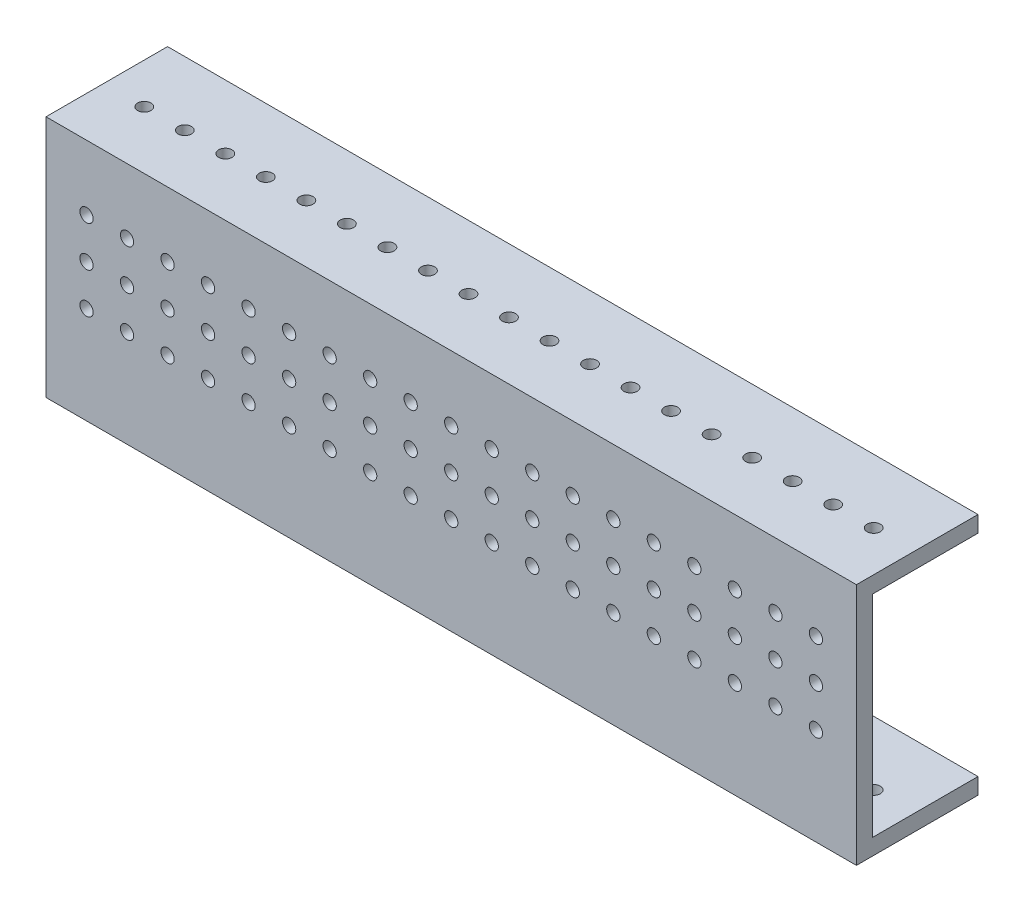
from build123d import *

# Parameters (mm, degrees)
BOSS_EXTRUDE1_DEPTH = 127
SKETCH2_R           = 2.0828
CUT_EXTRUDE1_DEPTH  = 150.326295407
SKETCH3_R           = 2.0828
CUT_EXTRUDE2_DEPTH  = 5.08


with BuildPart() as part:
    # Sketch1 → Boss-Extrude1 (new, symmetric)
    with BuildSketch(Plane(origin=(0, 0, 0), x_dir=(0, 0, -1), z_dir=(1, 0, 0))):
        Polygon((-13.97, 33.02), (19.05, 33.02), (19.05, 38.1), (-19.05, 38.1), (-19.05, -38.1), (19.05, -38.1), (19.05, -33.02), (-13.97, -33.02), align=None)
    extrude(amount=BOSS_EXTRUDE1_DEPTH, both=True)

    # Sketch2 → Cut-Extrude1 (cut, through all)
    with BuildSketch(Plane(origin=(0, 38.1, 0), x_dir=(1, 0, 0), z_dir=(0, 1, 0))):
        with Locations(Location((-114.3, -0.945134, 0), (0, 0, 270))):
            Circle(SKETCH2_R)
        with Locations(Location((-101.6, -0.945134, 0), (0, 0, 270))):
            Circle(SKETCH2_R)
        with Locations(Location((-88.9, -0.945134, 0), (0, 0, 270))):
            Circle(SKETCH2_R)
        with Locations(Location((-76.2, -0.945134, 0), (0, 0, 270))):
            Circle(SKETCH2_R)
        with Locations(Location((-63.5, -0.945134, 0), (0, 0, 270))):
            Circle(SKETCH2_R)
        with Locations(Location((-50.8, -0.945134, 0), (0, 0, 270))):
            Circle(SKETCH2_R)
        with Locations(Location((-38.1, -0.945134, 0), (0, 0, 270))):
            Circle(SKETCH2_R)
        with Locations(Location((-25.4, -0.945134, 0), (0, 0, 270))):
            Circle(SKETCH2_R)
        with Locations(Location((-12.7, -0.945134, 0), (0, 0, 270))):
            Circle(SKETCH2_R)
        with Locations(Location((0, -0.945134, 0), (0, 0, 270))):
            Circle(SKETCH2_R)
        with Locations(Location((12.7, -0.945134, 0), (0, 0, 270))):
            Circle(SKETCH2_R)
        with Locations(Location((25.4, -0.945134, 0), (0, 0, 270))):
            Circle(SKETCH2_R)
        with Locations(Location((38.1, -0.945134, 0), (0, 0, 270))):
            Circle(SKETCH2_R)
        with Locations(Location((50.8, -0.945134, 0), (0, 0, 270))):
            Circle(SKETCH2_R)
        with Locations(Location((63.5, -0.945134, 0), (0, 0, 270))):
            Circle(SKETCH2_R)
        with Locations(Location((76.2, -0.945134, 0), (0, 0, 270))):
            Circle(SKETCH2_R)
        with Locations(Location((88.9, -0.945134, 0), (0, 0, 270))):
            Circle(SKETCH2_R)
        with Locations(Location((101.6, -0.945134, 0), (0, 0, 270))):
            Circle(SKETCH2_R)
        with Locations(Location((114.3, -0.945134, 0), (0, 0, 270))):
            Circle(SKETCH2_R)
    extrude(amount=-CUT_EXTRUDE1_DEPTH, mode=Mode.SUBTRACT)

    # Sketch3 → Cut-Extrude2 (cut)
    with BuildSketch(Plane.XY.offset(19.05)):
        with Locations((-114.3, 17.78)):
            Circle(SKETCH3_R)
        with Locations((-101.6, 17.78)):
            Circle(SKETCH3_R)
        with Locations((-88.9, 17.78)):
            Circle(SKETCH3_R)
        with Locations((-76.2, 17.78)):
            Circle(SKETCH3_R)
        with Locations((-63.5, 17.78)):
            Circle(SKETCH3_R)
        with Locations((-50.8, 17.78)):
            Circle(SKETCH3_R)
        with Locations((-38.1, 17.78)):
            Circle(SKETCH3_R)
        with Locations((-25.4, 17.78)):
            Circle(SKETCH3_R)
        with Locations((-12.7, 17.78)):
            Circle(SKETCH3_R)
        with Locations((0, 17.78)):
            Circle(SKETCH3_R)
        with Locations((12.7, 17.78)):
            Circle(SKETCH3_R)
        with Locations((25.4, 17.78)):
            Circle(SKETCH3_R)
        with Locations((38.1, 17.78)):
            Circle(SKETCH3_R)
        with Locations((50.8, 17.78)):
            Circle(SKETCH3_R)
        with Locations((63.5, 17.78)):
            Circle(SKETCH3_R)
        with Locations((76.2, 17.78)):
            Circle(SKETCH3_R)
        with Locations((88.9, 17.78)):
            Circle(SKETCH3_R)
        with Locations((101.6, 17.78)):
            Circle(SKETCH3_R)
        with Locations((114.3, 17.78)):
            Circle(SKETCH3_R)
        with Locations((-101.6, 5.08)):
            Circle(SKETCH3_R)
        with Locations((-88.9, 5.08)):
            Circle(SKETCH3_R)
        with Locations((-76.2, 5.08)):
            Circle(SKETCH3_R)
        with Locations((-63.5, 5.08)):
            Circle(SKETCH3_R)
        with Locations((-50.8, 5.08)):
            Circle(SKETCH3_R)
        with Locations((-38.1, 5.08)):
            Circle(SKETCH3_R)
        with Locations((-25.4, 5.08)):
            Circle(SKETCH3_R)
        with Locations((-12.7, 5.08)):
            Circle(SKETCH3_R)
        with Locations((0, 5.08)):
            Circle(SKETCH3_R)
        with Locations((12.7, 5.08)):
            Circle(SKETCH3_R)
        with Locations((25.4, 5.08)):
            Circle(SKETCH3_R)
        with Locations((38.1, 5.08)):
            Circle(SKETCH3_R)
        with Locations((50.8, 5.08)):
            Circle(SKETCH3_R)
        with Locations((63.5, 5.08)):
            Circle(SKETCH3_R)
        with Locations((76.2, 5.08)):
            Circle(SKETCH3_R)
        with Locations((88.9, 5.08)):
            Circle(SKETCH3_R)
        with Locations((101.6, 5.08)):
            Circle(SKETCH3_R)
        with Locations((114.3, 5.08)):
            Circle(SKETCH3_R)
        with Locations((-101.6, -7.62)):
            Circle(SKETCH3_R)
        with Locations((-88.9, -7.62)):
            Circle(SKETCH3_R)
        with Locations((-76.2, -7.62)):
            Circle(SKETCH3_R)
        with Locations((-63.5, -7.62)):
            Circle(SKETCH3_R)
        with Locations((-50.8, -7.62)):
            Circle(SKETCH3_R)
        with Locations((-38.1, -7.62)):
            Circle(SKETCH3_R)
        with Locations((-25.4, -7.62)):
            Circle(SKETCH3_R)
        with Locations((-12.7, -7.62)):
            Circle(SKETCH3_R)
        with Locations((0, -7.62)):
            Circle(SKETCH3_R)
        with Locations((12.7, -7.62)):
            Circle(SKETCH3_R)
        with Locations((25.4, -7.62)):
            Circle(SKETCH3_R)
        with Locations((38.1, -7.62)):
            Circle(SKETCH3_R)
        with Locations((50.8, -7.62)):
            Circle(SKETCH3_R)
        with Locations((63.5, -7.62)):
            Circle(SKETCH3_R)
        with Locations((76.2, -7.62)):
            Circle(SKETCH3_R)
        with Locations((88.9, -7.62)):
            Circle(SKETCH3_R)
        with Locations((101.6, -7.62)):
            Circle(SKETCH3_R)
        with Locations((114.3, -7.62)):
            Circle(SKETCH3_R)
        with Locations((-114.3, 5.08)):
            Circle(SKETCH3_R)
        with Locations((-114.3, -7.62)):
            Circle(SKETCH3_R)
    extrude(amount=-CUT_EXTRUDE2_DEPTH, mode=Mode.SUBTRACT)


solid = part.part
